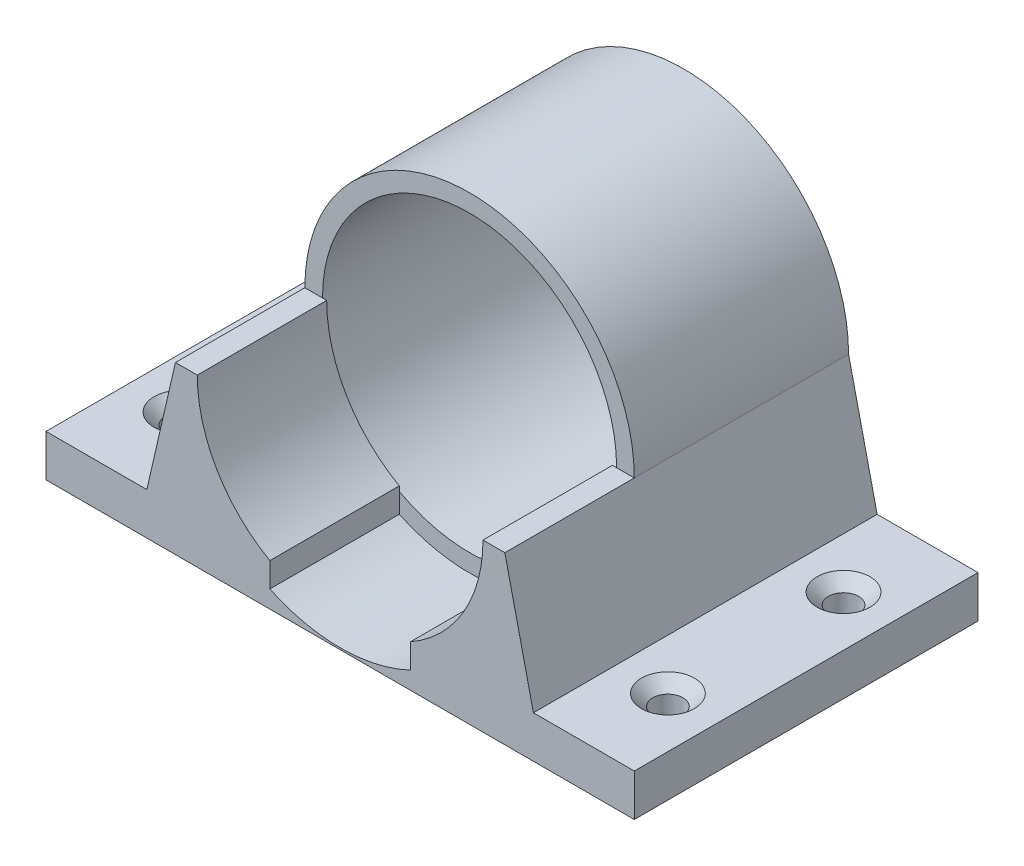
from build123d import *

# Parameters (mm, degrees)
SKETCH1_R                                       = 17.5
BOSS_EXTRUDE9_DEPTH                             = 25.5
BOSS_EXTRUDE10_DEPTH                            = 15.4
BOSS_EXTRUDE10_DEPTH_BACK                       = 25.5
CSK_FOR_M3_FLAT_HEAD_MACHINE_SCREW1_D           = 3.6
CSK_FOR_M3_FLAT_HEAD_MACHINE_SCREW1_CSINK_D     = 6.3
CSK_FOR_M3_FLAT_HEAD_MACHINE_SCREW1_CSINK_ANGLE = 90
CSK_FOR_M3_FLAT_HEAD_MACHINE_SCREW2_D           = 3.6
CSK_FOR_M3_FLAT_HEAD_MACHINE_SCREW2_CSINK_D     = 6.3
CSK_FOR_M3_FLAT_HEAD_MACHINE_SCREW2_CSINK_ANGLE = 90
BOSS_EXTRUDE12_DEPTH                            = 15.4


with BuildPart() as part:
    # Sketch1 → Boss-Extrude9 (new body)
    with BuildSketch(Plane.XY):
        with BuildLine():
            ThreePointArc((-19.6, 19.8), (0, 39.4), (19.6, 19.8))
            ThreePointArc((19.6, 19.8), (0, 0.2), (-19.6, 19.8))
        make_face()
        with Locations((0, 19.8)):
            Circle(SKETCH1_R, mode=Mode.SUBTRACT)
    extrude(amount=-BOSS_EXTRUDE9_DEPTH)

    # Sketch1<15> → Boss-Extrude10 (add, two sides: drawn at the far end of the back side and taken through both)
    with BuildSketch(Plane.XY.offset(-BOSS_EXTRUDE10_DEPTH_BACK)):
        with BuildLine():
            Line((-23, 5), (-35, 5))
            Line((-35, 5), (-35, 0))
            Line((-35, 0), (35, 0))
            Line((35, 0), (35, 5))
            Line((35, 5), (23, 5))
            Line((23, 5), (19.6, 19.8))
            ThreePointArc((19.6, 19.8), (0, 0.2), (-19.6, 19.8))
            Line((-19.6, 19.8), (-23, 5))
        make_face()
    extrude(amount=BOSS_EXTRUDE10_DEPTH + BOSS_EXTRUDE10_DEPTH_BACK)

    # CSK for M3 Flat Head Machine Screw1 (through all)
    with Locations(Plane(origin=(0, 5, 0), x_dir=(1, 0, 0), z_dir=(0, 1, 0))):
        with Locations((-29, 15.5), (-29, -5.4)):
            CounterSinkHole(CSK_FOR_M3_FLAT_HEAD_MACHINE_SCREW1_D / 2, CSK_FOR_M3_FLAT_HEAD_MACHINE_SCREW1_CSINK_D / 2, counter_sink_angle=CSK_FOR_M3_FLAT_HEAD_MACHINE_SCREW1_CSINK_ANGLE)

    # CSK for M3 Flat Head Machine Screw2 (through all)
    with Locations(Plane(origin=(0, 5, 0), x_dir=(1, 0, 0), z_dir=(0, 1, 0))):
        with Locations((29, -5.4), (29, 15.5)):
            CounterSinkHole(CSK_FOR_M3_FLAT_HEAD_MACHINE_SCREW2_D / 2, CSK_FOR_M3_FLAT_HEAD_MACHINE_SCREW2_CSINK_D / 2, counter_sink_angle=CSK_FOR_M3_FLAT_HEAD_MACHINE_SCREW2_CSINK_ANGLE)

    # Sketch20 → Boss-Extrude12 (add)
    with BuildSketch(Plane.XY):
        with BuildLine():
            ThreePointArc((-19.6, 19.8), (-16.554433025, 9.30663318), (-8.364209467, 2.074312425))
            Line((-8.364209467, 2.074312425), (-8.364209467, 5))
            ThreePointArc((-8.364209467, 5), (-14.683180189, 11.232373751), (-17, 19.8))
            Line((-17, 19.8), (-19.6, 19.8))
        make_face()
        with BuildLine():
            Line((8.364209467, 5), (8.364209467, 2.074312425))
            ThreePointArc((8.364209467, 2.074312425), (16.554433025, 9.30663318), (19.6, 19.8))
            Line((19.6, 19.8), (17, 19.8))
            ThreePointArc((17, 19.8), (14.683180189, 11.232373751), (8.364209467, 5))
        make_face()
    extrude(amount=BOSS_EXTRUDE12_DEPTH)


solid = part.part
